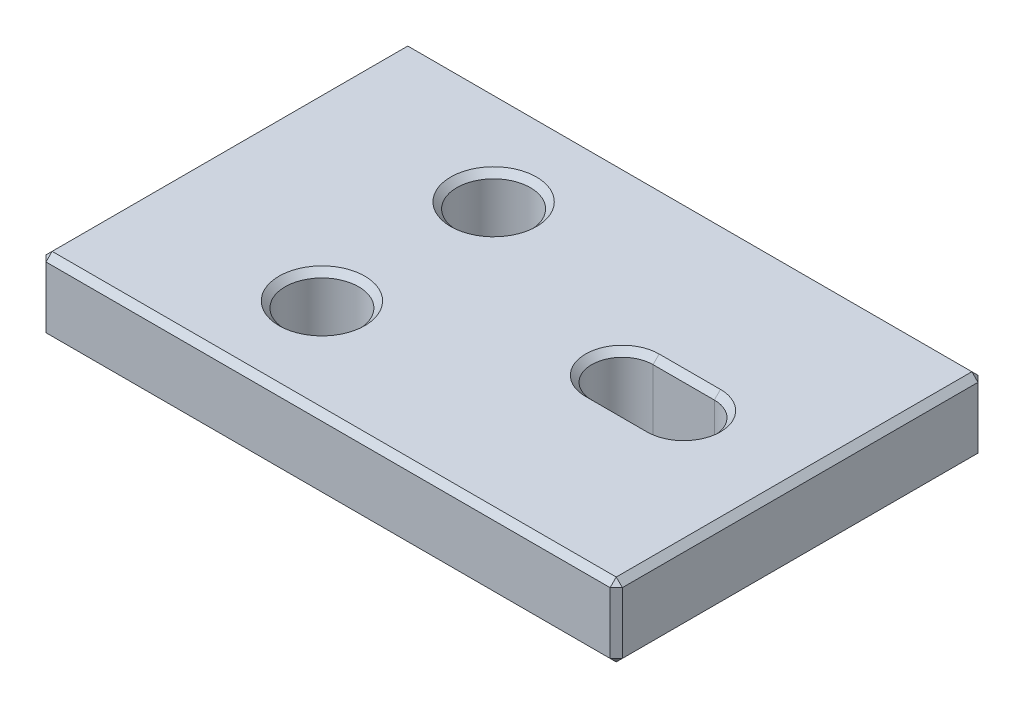
from build123d import *

# Parameters (mm, degrees)
CROQUIS1_W              = 47
CROQUIS1_H              = 30
CROQUIS1_R              = 3
SALIENTE_EXTRUIR1_DEPTH = 6
CHAFL_N1_SIZE           = 0.5


with BuildPart() as part:
    # Croquis1 → Saliente-Extruir1 (new body)
    with BuildSketch(Plane(origin=(0, 0, 0), x_dir=(1, 0, 0), z_dir=(0, 1, 0))):
        with Locations((16.271686308, -8.221461187)):
            Rectangle(CROQUIS1_W, CROQUIS1_H)
        with Locations(Location((7.771686308, -1.221461187, 0), (0, 0, 270))):
            Circle(CROQUIS1_R, mode=Mode.SUBTRACT)
        with Locations(Location((7.771686308, -15.221461187, 0), (0, 0, 270))):
            Circle(CROQUIS1_R, mode=Mode.SUBTRACT)
        with BuildLine():
            Line((30.271686308, -10.721461187), (25.271686308, -10.721461187))
            ThreePointArc((25.271686308, -10.721461187), (22.771686308, -8.221461187), (25.271686308, -5.721461187))
            Line((25.271686308, -5.721461187), (30.271686308, -5.721461187))
            ThreePointArc((30.271686308, -5.721461187), (32.771686308, -8.221461187), (30.271686308, -10.721461187))
        make_face(mode=Mode.SUBTRACT)
    extrude(amount=SALIENTE_EXTRUIR1_DEPTH)

    # Chaflán1
    chafl_n1_edges = [part.edges().sort_by_distance(p)[0] for p in [
        (39.771686308, 6, 8.221461187),
        (16.271686308, 6, -6.778538813),
        (32.771686308, 0, 8.221461187),
        (27.771686308, 0, 5.721461187),
        (22.771686308, 0, 8.221461187),
        (27.771686308, 0, 10.721461187),
        (32.771686308, 6, 8.221461187),
        (27.771686308, 6, 5.721461187),
        (22.771686308, 6, 8.221461187),
        (27.771686308, 6, 10.721461187),
        (7.771686308, 0, -1.778538813),
        (7.771686308, 6, -1.778538813),
        (7.771686308, 0, 12.221461187),
        (7.771686308, 6, 12.221461187),
        (-7.228313692, 6, 8.221461187),
        (16.271686308, 0, -6.778538813),
        (39.771686308, 0, 8.221461187),
        (16.271686308, 0, 23.221461187),
        (-7.228313692, 0, 8.221461187),
        (16.271686308, 6, 23.221461187),
        (-7.228313692, 3, -6.778538813),
        (39.771686308, 3, -6.778538813),
        (39.771686308, 3, 23.221461187),
        (-7.228313692, 3, 23.221461187),
    ]]
    chamfer(chafl_n1_edges, length=CHAFL_N1_SIZE)


solid = part.part
